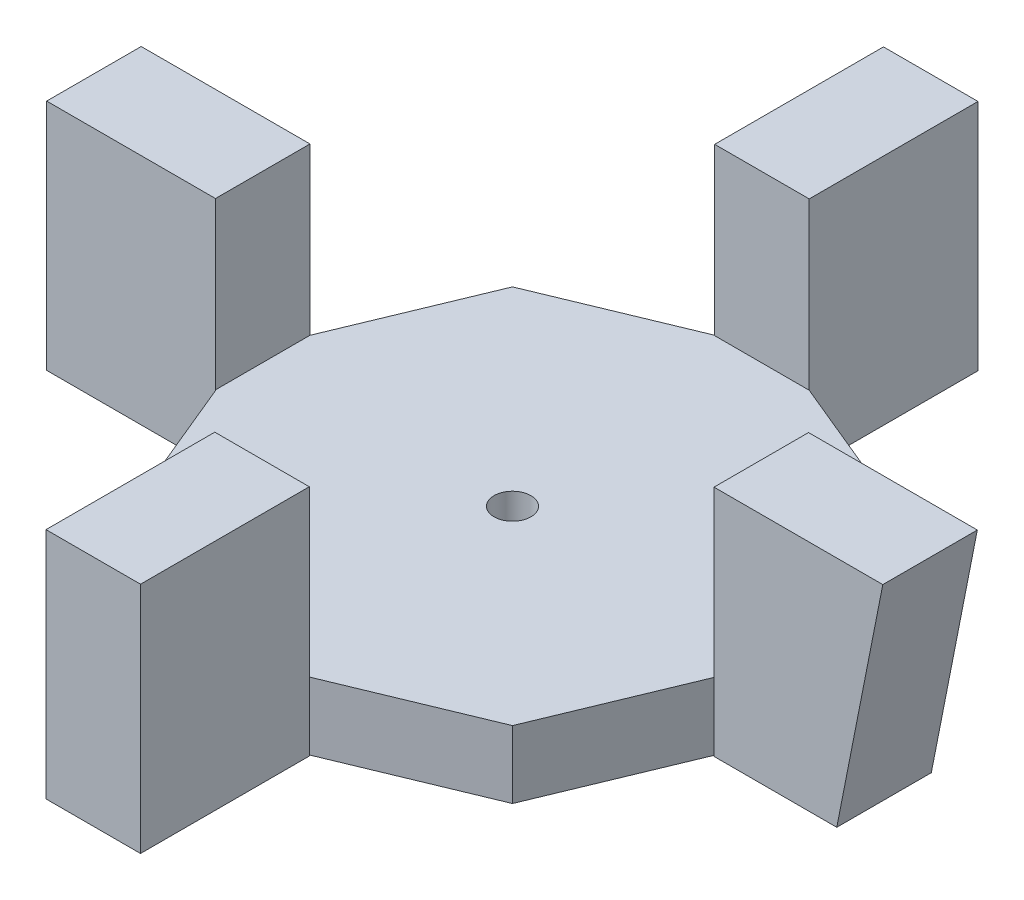
from build123d import *

# Parameters (mm, degrees)
SKETCH1_R           = 1.5
BOSS_EXTRUDE5_DEPTH = 2.75
SKETCH1_10_W        = 7.7
SKETCH1_10_H        = 13.75
SKETCH1_10_W_2      = 13.75
SKETCH1_10_H_2      = 7.7
BOSS_EXTRUDE6_DEPTH = 16.25
CUT_EXTRUDE2_DEPTH  = 16.25


with BuildPart() as part:
    # Sketch1 → Boss-Extrude5 (new, symmetric)
    with BuildSketch(Plane(origin=(0, 0, 0), x_dir=(1, 0, 0), z_dir=(0, 1, 0))):
        Polygon((3.85, -34.15), (3.85, -20.4), (3.586127609, -20.4), (15.475330795, -15.475330795), (20.361356783, -3.679420587), (20.361356783, -3.943292979), (34.111356783, -3.943292979), (34.111356783, 3.756707021), (20.361356783, 3.756707021), (20.361356783, 3.679420587), (15.475330795, 15.475330795), (3.904649762, 20.268063804), (3.904649762, 34.018063804), (-3.795350238, 34.018063804), (-3.795350238, 20.313337149), (-15.475330795, 15.475330795), (-20.306707021, 3.811356783), (-34.056707021, 3.811356783), (-34.056707021, -3.888643217), (-20.306707021, -3.888643217), (-20.306707021, -3.811356783), (-15.475330795, -15.475330795), (-3.586127609, -20.4), (-3.85, -20.4), (-3.85, -34.15), align=None)
        Circle(SKETCH1_R, mode=Mode.SUBTRACT)
    extrude(amount=BOSS_EXTRUDE5_DEPTH, both=True)

    # Sketch1<10> → Boss-Extrude6 (add)
    with BuildSketch(Plane(origin=(0, 0, 0), x_dir=(1, 0, 0), z_dir=(0, 1, 0))):
        with Locations((0, -27.275)):
            Rectangle(SKETCH1_10_W, SKETCH1_10_H)
        with Locations((27.236356783, -0.093292979)):
            Rectangle(SKETCH1_10_W_2, SKETCH1_10_H_2)
        with Locations((-27.181707021, -0.038643217)):
            Rectangle(SKETCH1_10_W_2, SKETCH1_10_H_2)
        with Locations((0.054649762, 27.143063804)):
            Rectangle(SKETCH1_10_W, SKETCH1_10_H)
    extrude(amount=BOSS_EXTRUDE6_DEPTH)

    # Sketch3 → Cut-Extrude2 (cut)
    with BuildSketch(Plane(origin=(0, 0, -3.756707021), x_dir=(-1, 0, 0), z_dir=(0, 0, -1))):
        Polygon((-30.361356783, -2.75), (-34.111356783, 16.25), (-34.111356783, -2.75), align=None)
    extrude(amount=-CUT_EXTRUDE2_DEPTH, mode=Mode.SUBTRACT)


solid = part.part
